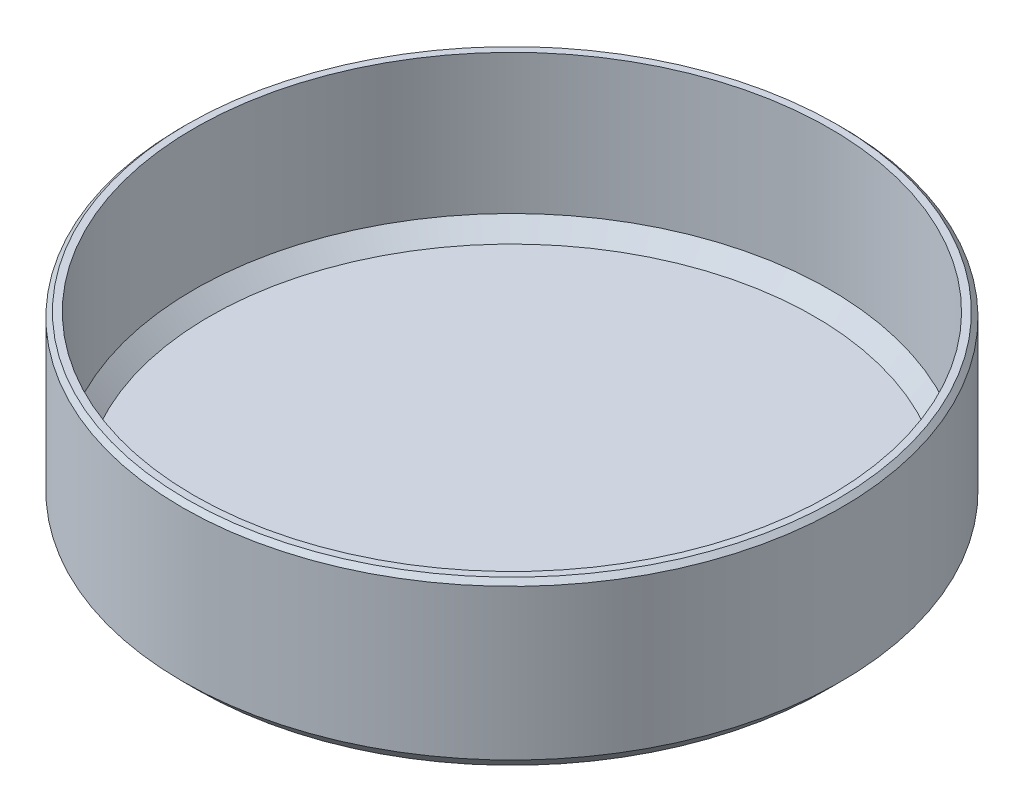
from build123d import *

# Parameters (mm, degrees)
SKETCH1_R           = 42.5
BOSS_EXTRUDE1_DEPTH = 2
SKETCH2_R           = 42.5
SKETCH2_R_2         = 41
BOSS_EXTRUDE2_DEPTH = 20
CHAMFER1_SIZE       = 2
CHAMFER2_SIZE       = 0.6


with BuildPart() as part:
    # Sketch1 → Boss-Extrude1 (new body)
    with BuildSketch(Plane(origin=(0, 0, 0), x_dir=(1, 0, 0), z_dir=(0, 1, 0))):
        with Locations(Location((0, 0, 0), (0, 0, 270))):
            Circle(SKETCH1_R)
    extrude(amount=BOSS_EXTRUDE1_DEPTH)

    # Sketch2 → Boss-Extrude2 (add)
    with BuildSketch(Plane(origin=(0, 2, 0), x_dir=(1, 0, 0), z_dir=(0, 1, 0))):
        with Locations(Location((0, 0, 0), (0, 0, 270))):
            Circle(SKETCH2_R)
        with Locations(Location((0, 0, 0), (0, 0, 270))):
            Circle(SKETCH2_R_2, mode=Mode.SUBTRACT)
    extrude(amount=BOSS_EXTRUDE2_DEPTH)

    # Chamfer1
    chamfer1_edges = [part.edges().sort_by_distance(p)[0] for p in [
        (0, 0, -42.5),
        (0, 2, -41),
    ]]
    chamfer(chamfer1_edges, length=CHAMFER1_SIZE)

    # Chamfer2
    chamfer2_edges = [part.edges().sort_by_distance(p)[0] for p in [
        (0, 22, -42.5),
    ]]
    chamfer(chamfer2_edges, length=CHAMFER2_SIZE)


solid = part.part
